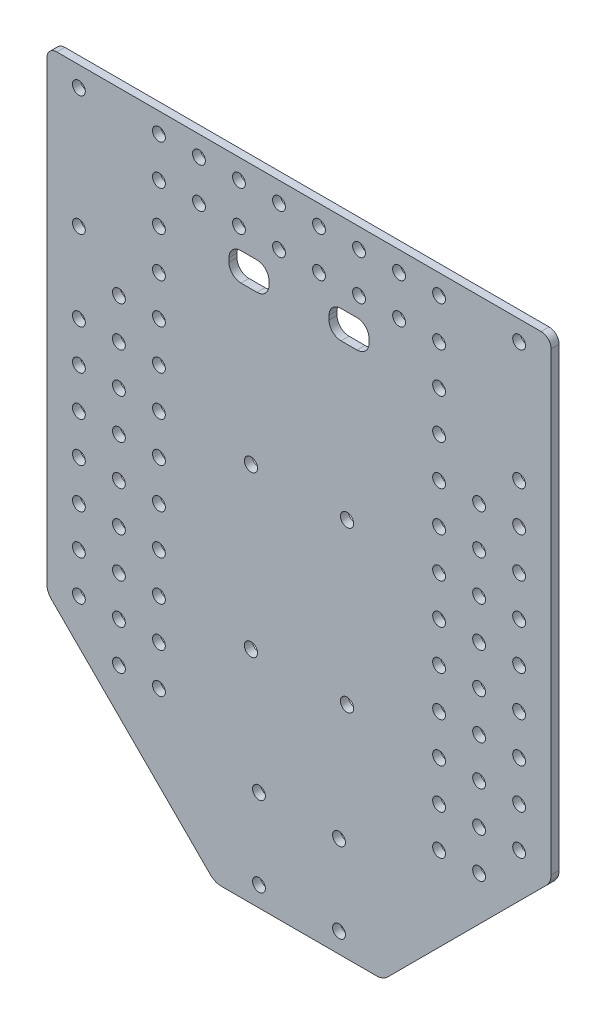
from build123d import *

# Parameters (mm, degrees)
SKETCH_1_W              = 126
SKETCH_1_H              = 160
EXTRUDE_427_DEPTH       = 2
CUT_EXTRUDE_997_REACH   = 173.968
SKETCH_2_R              = 1.6
SKETCH_3_R              = 1.65
CUT_EXTRUDE_1271_DEPTH  = 172.968020283
CHAMFER_2_SIZE          = 42
CHAMFER_1_SIZE          = 42
FILLET_1_R              = 4
SKETCH_6_W              = 10
SKETCH_6_H              = 7
CUT_EXTRUDE_2009_DEPTH  = 172.968020283
SKETCH_4_R              = 1.6
CUT_EXTRUDE_10_10_DEPTH = 172.968020283
FILLET_2_R              = 3
FILLET_3_R              = 2.5


with BuildPart() as part:
    # Эскиз1 → Extrude 427 (new body)
    with BuildSketch(Plane.XY):
        with Locations((0, -80)):
            Rectangle(SKETCH_1_W, SKETCH_1_H)
    extrude(amount=EXTRUDE_427_DEPTH)

    # Эскиз2 → Cut-Extrude 997 (cut, up to next)
    with BuildSketch(Plane.XY.offset(2), mode=Mode.PRIVATE) as cut_extrude_997_sk1:
        with Locations((10, -135)):
            Circle(SKETCH_2_R)
    cut_extrude_997_tool1 = extrude(cut_extrude_997_sk1.sketch, amount=-CUT_EXTRUDE_997_REACH, mode=Mode.PRIVATE) & part.part
    # Эскиз2 → Cut-Extrude 997 (cut, up to next)
    with BuildSketch(Plane.XY.offset(2), mode=Mode.PRIVATE) as cut_extrude_997_sk2:
        with Locations((-10, -135)):
            Circle(SKETCH_2_R)
    cut_extrude_997_tool2 = extrude(cut_extrude_997_sk2.sketch, amount=-CUT_EXTRUDE_997_REACH, mode=Mode.PRIVATE) & part.part
    # Эскиз2 → Cut-Extrude 997 (cut, up to next)
    with BuildSketch(Plane.XY.offset(2), mode=Mode.PRIVATE) as cut_extrude_997_sk3:
        with Locations((-10, -155)):
            Circle(SKETCH_2_R)
    cut_extrude_997_tool3 = extrude(cut_extrude_997_sk3.sketch, amount=-CUT_EXTRUDE_997_REACH, mode=Mode.PRIVATE) & part.part
    # Эскиз2 → Cut-Extrude 997 (cut, up to next)
    with BuildSketch(Plane.XY.offset(2), mode=Mode.PRIVATE) as cut_extrude_997_sk4:
        with Locations((10, -155)):
            Circle(SKETCH_2_R)
    cut_extrude_997_tool4 = extrude(cut_extrude_997_sk4.sketch, amount=-CUT_EXTRUDE_997_REACH, mode=Mode.PRIVATE) & part.part
    add(cut_extrude_997_tool1.solids().sort_by_distance((10, -135, 2))[0], mode=Mode.SUBTRACT)
    add(cut_extrude_997_tool2.solids().sort_by_distance((-10, -135, 2))[0], mode=Mode.SUBTRACT)
    add(cut_extrude_997_tool3.solids().sort_by_distance((-10, -155, 2))[0], mode=Mode.SUBTRACT)
    add(cut_extrude_997_tool4.solids().sort_by_distance((10, -155, 2))[0], mode=Mode.SUBTRACT)

    # Эскиз3 → Cut-Extrude 1271 (cut, through all)
    with BuildSketch(Plane(origin=(0, 0, 0), x_dir=(-1, 0, 0), z_dir=(0, 0, -1))):
        with Locations((-12, -65)):
            Circle(SKETCH_3_R)
        with Locations((12, -65)):
            Circle(SKETCH_3_R)
        with Locations((12, -105)):
            Circle(SKETCH_3_R)
        with Locations((-12, -105)):
            Circle(SKETCH_3_R)
    extrude(amount=-CUT_EXTRUDE_1271_DEPTH, mode=Mode.SUBTRACT)

    # Фаска2
    chamfer_2_edges = [part.edges().sort_by_distance(p)[0] for p in [
        (-63, -160, 1),
    ]]
    chamfer(chamfer_2_edges, length=CHAMFER_2_SIZE)

    # Фаска1
    chamfer_1_edges = [part.edges().sort_by_distance(p)[0] for p in [
        (63, -160, 1),
    ]]
    chamfer(chamfer_1_edges, length=CHAMFER_1_SIZE)

    # Скругление1
    fillet_1_edges = [part.edges().sort_by_distance(p)[0] for p in [
        (-21, -160, 1),
        (-63, -118, 1),
        (63, -118, 1),
        (21, -160, 1),
    ]]
    fillet(fillet_1_edges, radius=FILLET_1_R)

    # Эскиз6 → Cut-Extrude 2009 (cut, through all)
    with BuildSketch(Plane(origin=(0, 0, 0), x_dir=(-1, 0, 0), z_dir=(0, 0, -1))):
        with Locations((-12.5, -23.5)):
            Rectangle(SKETCH_6_W, SKETCH_6_H)
        with Locations((12.5, -23.5)):
            Rectangle(SKETCH_6_W, SKETCH_6_H)
    extrude(amount=-CUT_EXTRUDE_2009_DEPTH, mode=Mode.SUBTRACT)

    # Эскиз4 → Сетка отв 10х10 (cut, through all)
    with BuildSketch(Plane(origin=(0, 0, 0), x_dir=(-1, 0, 0), z_dir=(0, 0, -1))):
        with Locations((35, -125)):
            Circle(SKETCH_4_R)
        with Locations((45, -125)):
            Circle(SKETCH_4_R)
        with Locations(Location((-45, -125, 0), (0, 0, 180))):
            Circle(SKETCH_4_R)
        with Locations(Location((-35, -125, 0), (0, 0, 180))):
            Circle(SKETCH_4_R)
        with Locations((35, -115)):
            Circle(SKETCH_4_R)
        with Locations((45, -115)):
            Circle(SKETCH_4_R)
        with Locations((55, -115)):
            Circle(SKETCH_4_R)
        with Locations(Location((-55, -115, 0), (0, 0, 180))):
            Circle(SKETCH_4_R)
        with Locations(Location((-45, -115, 0), (0, 0, 180))):
            Circle(SKETCH_4_R)
        with Locations(Location((-35, -115, 0), (0, 0, 180))):
            Circle(SKETCH_4_R)
        with Locations((35, -105)):
            Circle(SKETCH_4_R)
        with Locations((45, -105)):
            Circle(SKETCH_4_R)
        with Locations((55, -105)):
            Circle(SKETCH_4_R)
        with Locations(Location((-55, -105, 0), (0, 0, 180))):
            Circle(SKETCH_4_R)
        with Locations(Location((-45, -105, 0), (0, 0, 180))):
            Circle(SKETCH_4_R)
        with Locations(Location((-35, -105, 0), (0, 0, 180))):
            Circle(SKETCH_4_R)
        with Locations((35, -95)):
            Circle(SKETCH_4_R)
        with Locations((45, -95)):
            Circle(SKETCH_4_R)
        with Locations((55, -95)):
            Circle(SKETCH_4_R)
        with Locations(Location((-55, -95, 0), (0, 0, 180))):
            Circle(SKETCH_4_R)
        with Locations(Location((-45, -95, 0), (0, 0, 180))):
            Circle(SKETCH_4_R)
        with Locations(Location((-35, -95, 0), (0, 0, 180))):
            Circle(SKETCH_4_R)
        with Locations((35, -85)):
            Circle(SKETCH_4_R)
        with Locations((45, -85)):
            Circle(SKETCH_4_R)
        with Locations((55, -85)):
            Circle(SKETCH_4_R)
        with Locations(Location((-55, -85, 0), (0, 0, 180))):
            Circle(SKETCH_4_R)
        with Locations(Location((-45, -85, 0), (0, 0, 180))):
            Circle(SKETCH_4_R)
        with Locations(Location((-35, -85, 0), (0, 0, 180))):
            Circle(SKETCH_4_R)
        with Locations((35, -75)):
            Circle(SKETCH_4_R)
        with Locations((45, -75)):
            Circle(SKETCH_4_R)
        with Locations((55, -75)):
            Circle(SKETCH_4_R)
        with Locations(Location((-55, -75, 0), (0, 0, 180))):
            Circle(SKETCH_4_R)
        with Locations(Location((-45, -75, 0), (0, 0, 180))):
            Circle(SKETCH_4_R)
        with Locations(Location((-35, -75, 0), (0, 0, 180))):
            Circle(SKETCH_4_R)
        with Locations((35, -65)):
            Circle(SKETCH_4_R)
        with Locations((45, -65)):
            Circle(SKETCH_4_R)
        with Locations((55, -65)):
            Circle(SKETCH_4_R)
        with Locations(Location((-55, -65, 0), (0, 0, 180))):
            Circle(SKETCH_4_R)
        with Locations(Location((-45, -65, 0), (0, 0, 180))):
            Circle(SKETCH_4_R)
        with Locations(Location((-35, -65, 0), (0, 0, 180))):
            Circle(SKETCH_4_R)
        with Locations((35, -55)):
            Circle(SKETCH_4_R)
        with Locations((45, -55)):
            Circle(SKETCH_4_R)
        with Locations((55, -55)):
            Circle(SKETCH_4_R)
        with Locations(Location((-55, -55, 0), (0, 0, 180))):
            Circle(SKETCH_4_R)
        with Locations(Location((-45, -55, 0), (0, 0, 180))):
            Circle(SKETCH_4_R)
        with Locations(Location((-35, -55, 0), (0, 0, 180))):
            Circle(SKETCH_4_R)
        with Locations((35, -45)):
            Circle(SKETCH_4_R)
        with Locations((45, -45)):
            Circle(SKETCH_4_R)
        with Locations(Location((-55, -45, 0), (0, 0, 180))):
            Circle(SKETCH_4_R)
        with Locations(Location((-45, -45, 0), (0, 0, 180))):
            Circle(SKETCH_4_R)
        with Locations(Location((-35, -45, 0), (0, 0, 180))):
            Circle(SKETCH_4_R)
        with Locations((35, -35)):
            Circle(SKETCH_4_R)
        with Locations((55, -35)):
            Circle(SKETCH_4_R)
        with Locations(Location((-55, -35, 0), (0, 0, 180))):
            Circle(SKETCH_4_R)
        with Locations(Location((-35, -35, 0), (0, 0, 180))):
            Circle(SKETCH_4_R)
        with Locations((35, -25)):
            Circle(SKETCH_4_R)
        with Locations(Location((-35, -25, 0), (0, 0, 180))):
            Circle(SKETCH_4_R)
        with Locations((5, -15)):
            Circle(SKETCH_4_R)
        with Locations((15, -15)):
            Circle(SKETCH_4_R)
        with Locations((25, -15)):
            Circle(SKETCH_4_R)
        with Locations((35, -15)):
            Circle(SKETCH_4_R)
        with Locations(Location((-35, -15, 0), (0, 0, 180))):
            Circle(SKETCH_4_R)
        with Locations(Location((-25, -15, 0), (0, 0, 180))):
            Circle(SKETCH_4_R)
        with Locations(Location((-15, -15, 0), (0, 0, 180))):
            Circle(SKETCH_4_R)
        with Locations(Location((-5, -15, 0), (0, 0, 180))):
            Circle(SKETCH_4_R)
        with Locations((5, -5)):
            Circle(SKETCH_4_R)
        with Locations((15, -5)):
            Circle(SKETCH_4_R)
        with Locations((25, -5)):
            Circle(SKETCH_4_R)
        with Locations((35, -5)):
            Circle(SKETCH_4_R)
        with Locations((55, -5)):
            Circle(SKETCH_4_R)
        with Locations(Location((-55, -5, 0), (0, 0, 180))):
            Circle(SKETCH_4_R)
        with Locations(Location((-35, -5, 0), (0, 0, 180))):
            Circle(SKETCH_4_R)
        with Locations(Location((-25, -5, 0), (0, 0, 180))):
            Circle(SKETCH_4_R)
        with Locations(Location((-15, -5, 0), (0, 0, 180))):
            Circle(SKETCH_4_R)
        with Locations(Location((-5, -5, 0), (0, 0, 180))):
            Circle(SKETCH_4_R)
    extrude(amount=-CUT_EXTRUDE_10_10_DEPTH, mode=Mode.SUBTRACT)

    # Скругление2
    fillet_2_edges = [part.edges().sort_by_distance(p)[0] for p in [
        (-7.5, -20, 1),
        (-17.5, -20, 1),
        (-17.5, -27, 1),
        (-7.5, -27, 1),
        (17.5, -27, 1),
        (17.5, -20, 1),
        (7.5, -20, 1),
        (7.5, -27, 1),
    ]]
    fillet(fillet_2_edges, radius=FILLET_2_R)

    # Скругление3
    fillet_3_edges = [part.edges().sort_by_distance(p)[0] for p in [
        (-63, 0, 1),
        (63, 0, 1),
    ]]
    fillet(fillet_3_edges, radius=FILLET_3_R)


solid = part.part
